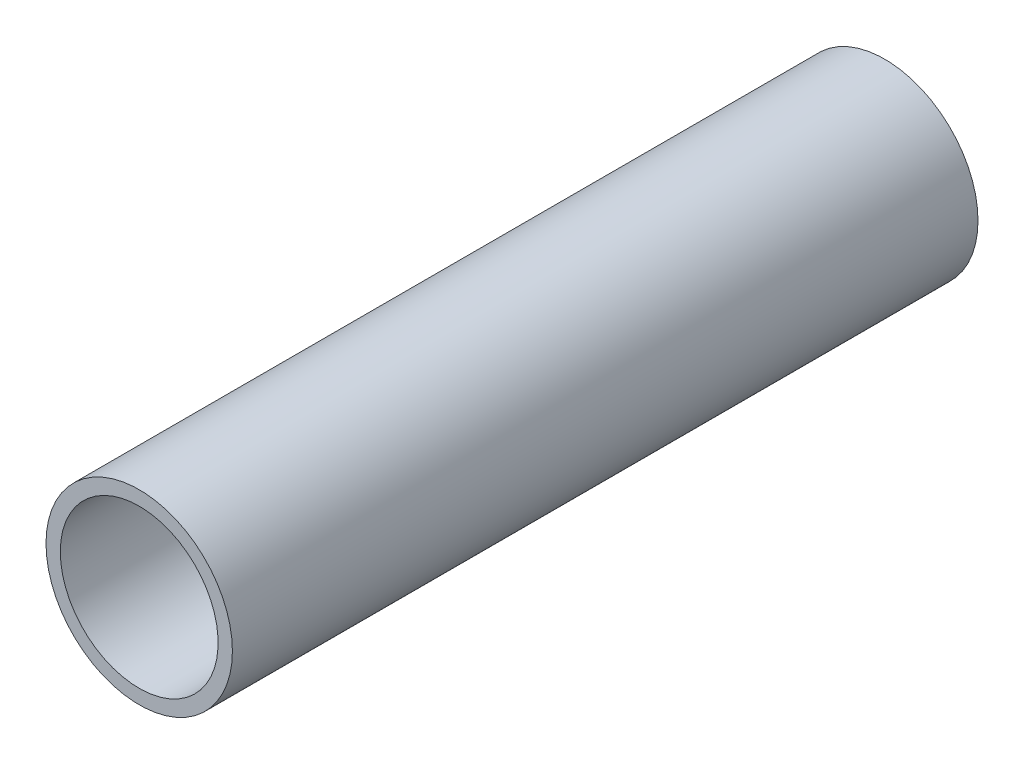
from build123d import *

# Parameters (mm, degrees)
SKETCH1_R           = 19.05
SKETCH1_R_2         = 16.129
BOSS_EXTRUDE1_DEPTH = 152.4


with BuildPart() as part:
    # Sketch1 → Boss-Extrude1 (new body)
    with BuildSketch(Plane.XY):
        with Locations(Location((0, 0, 0), (0, 0, 180))):
            Circle(SKETCH1_R)
        with Locations(Location((0, 0, 0), (0, 0, 180))):
            Circle(SKETCH1_R_2, mode=Mode.SUBTRACT)
    extrude(amount=BOSS_EXTRUDE1_DEPTH)


solid = part.part
